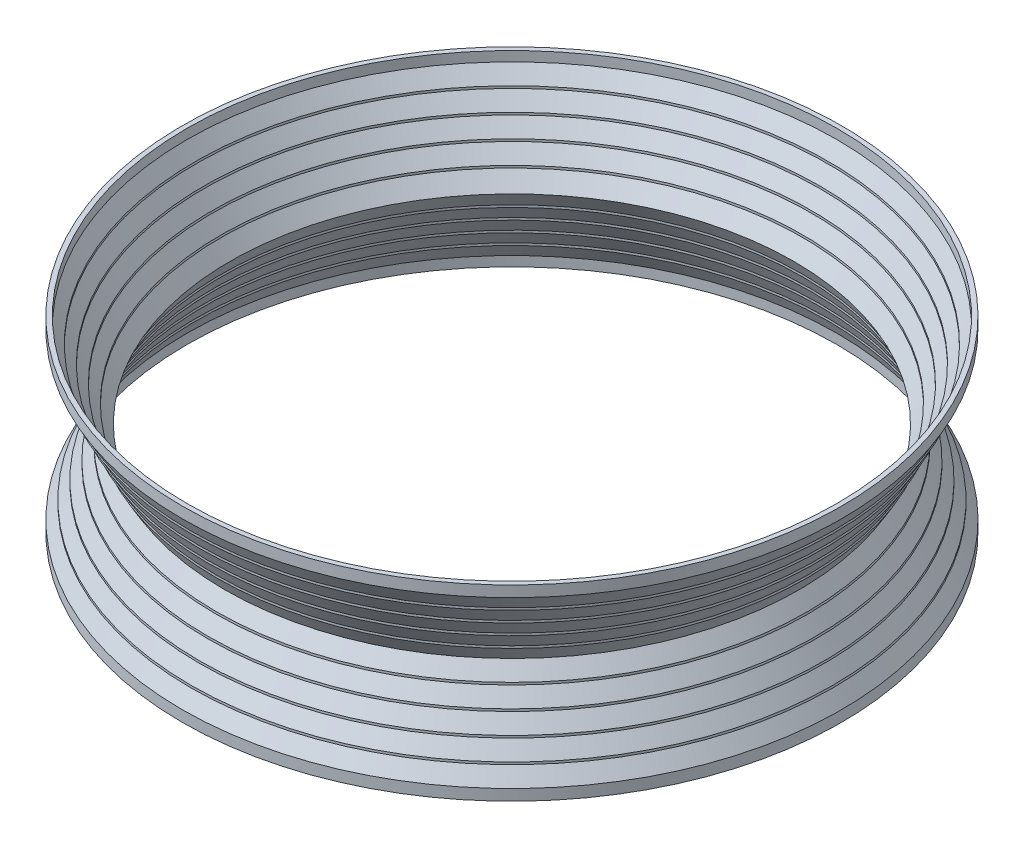
from build123d import *

# Parameters (mm, degrees)
SKETCH_1_R      = 35.893803705
EXTRUDE_1_DEPTH = 1.2
SKETCH_4_W      = 15.348825641
SKETCH_4_H      = 9
SHELL_1_T       = -0.5


with BuildPart() as part:
    # 스케치1 → 보스-돌출1 (new body)
    with BuildSketch(Plane(origin=(0, 0, 0), x_dir=(1, 0, 0), z_dir=(0, 1, 0))):
        with Locations(Location((0, 0, 0), (0, 0, 270))):
            Circle(SKETCH_1_R)
    extrude_1 = extrude(amount=EXTRUDE_1_DEPTH)

    # 스케치4 → 회전1 (revolve)
    with BuildSketch(Plane(origin=(0, 0, 0), x_dir=(0, 0, -1), z_dir=(1, 0, 0))):
        Polygon((-34.970043274, 2.8), (-35.893803705, 1.2), (-15.348825641, 1.2), (-15.348825641, 10.2), (-30.697651282, 10.2), (-31.275001551, 10.2), (-32.198761982, 8.6), (-32.198761982, 8.35), (-33.122522413, 6.75), (-33.122522413, 6.5), (-34.046282843, 4.9), (-34.046282843, 4.65), (-34.970043274, 3.05), align=None)
        with Locations((-7.674412821, 5.7)):
            Rectangle(SKETCH_4_W, SKETCH_4_H)
    revolve_1 = revolve(axis=Axis((0, 10.2, 0), (0, -1, 0)))


with BuildPart() as mirror_1_1:
    # 대칭 복사1: 보스-돌출1, 회전1 across 평면1
    add(extrude_1.mirror(Plane(origin=(0, 10.2, 0), x_dir=(1, 0, 0), z_dir=(0, 1, 0))))
    add(revolve_1.mirror(Plane(origin=(0, 10.2, 0), x_dir=(1, 0, 0), z_dir=(0, 1, 0))))


with BuildPart() as part_1:
    add(part.part)

    # 대칭 복사1 united with what the copies tou: union 대칭 복사1_1
    add(mirror_1_1.part)

    # 쉘1
    shell_1_openings = [part_1.faces().sort_by_distance(p)[0] for p in [
        (0, 20.4, 0),
        (0, 0, 0),
    ]]
    offset(amount=SHELL_1_T, openings=shell_1_openings, kind=Kind.INTERSECTION)


solid = part_1.part
